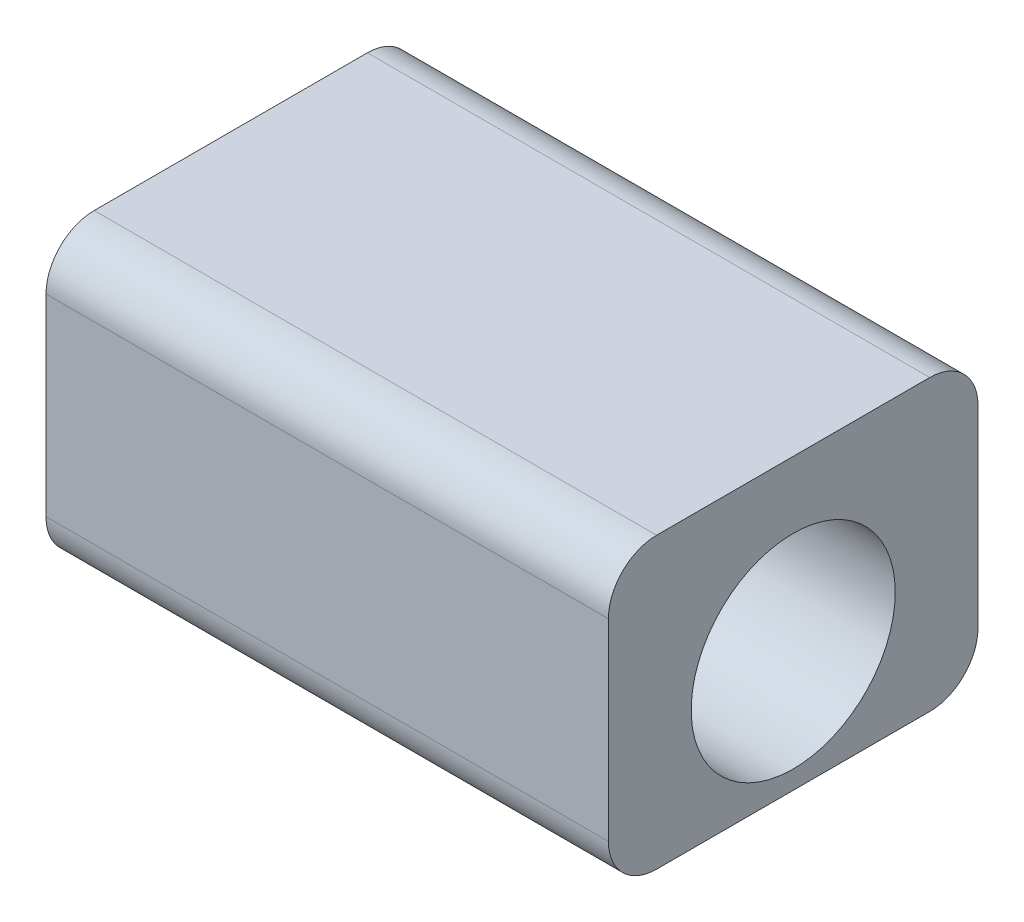
from build123d import *

# Parameters (mm, degrees)
SKETCH1_R           = 12.7
BOSS_EXTRUDE1_DEPTH = 35


with BuildPart() as part:
    # Sketch1 → Boss-Extrude1 (new, symmetric)
    with BuildSketch(Plane(origin=(0, 0, 0), x_dir=(0, 0, -1), z_dir=(1, 0, 0))):
        with BuildLine():
            Line((-17, -15), (17, -15))
            ThreePointArc((17, -15), (21.242640687, -13.242640687), (23, -9))
            Line((23, -9), (23, 15))
            ThreePointArc((23, 15), (21.242640687, 19.242640687), (17, 21))
            Line((17, 21), (-17, 21))
            ThreePointArc((-17, 21), (-21.242640687, 19.242640687), (-23, 15))
            Line((-23, 15), (-23, -9))
            ThreePointArc((-23, -9), (-21.242640687, -13.242640687), (-17, -15))
        make_face()
        Circle(SKETCH1_R, mode=Mode.SUBTRACT)
    extrude(amount=BOSS_EXTRUDE1_DEPTH, both=True)


solid = part.part
